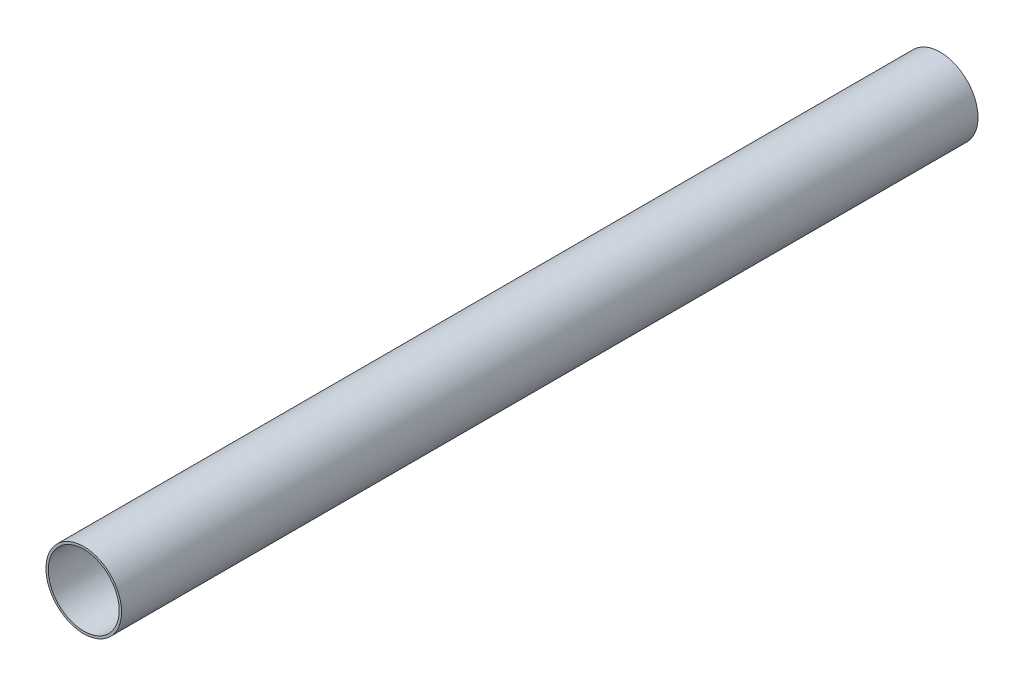
from build123d import *

# Parameters (mm, degrees)
SKETCH1_R           = 25.4
SKETCH1_R_2         = 23.8125
BOSS_EXTRUDE1_DEPTH = 287.606496287


with BuildPart() as part:
    # Sketch1 → Boss-Extrude1 (new, symmetric)
    with BuildSketch(Plane.XY):
        Circle(SKETCH1_R)
        Circle(SKETCH1_R_2, mode=Mode.SUBTRACT)
    extrude(amount=BOSS_EXTRUDE1_DEPTH, both=True)


solid = part.part
